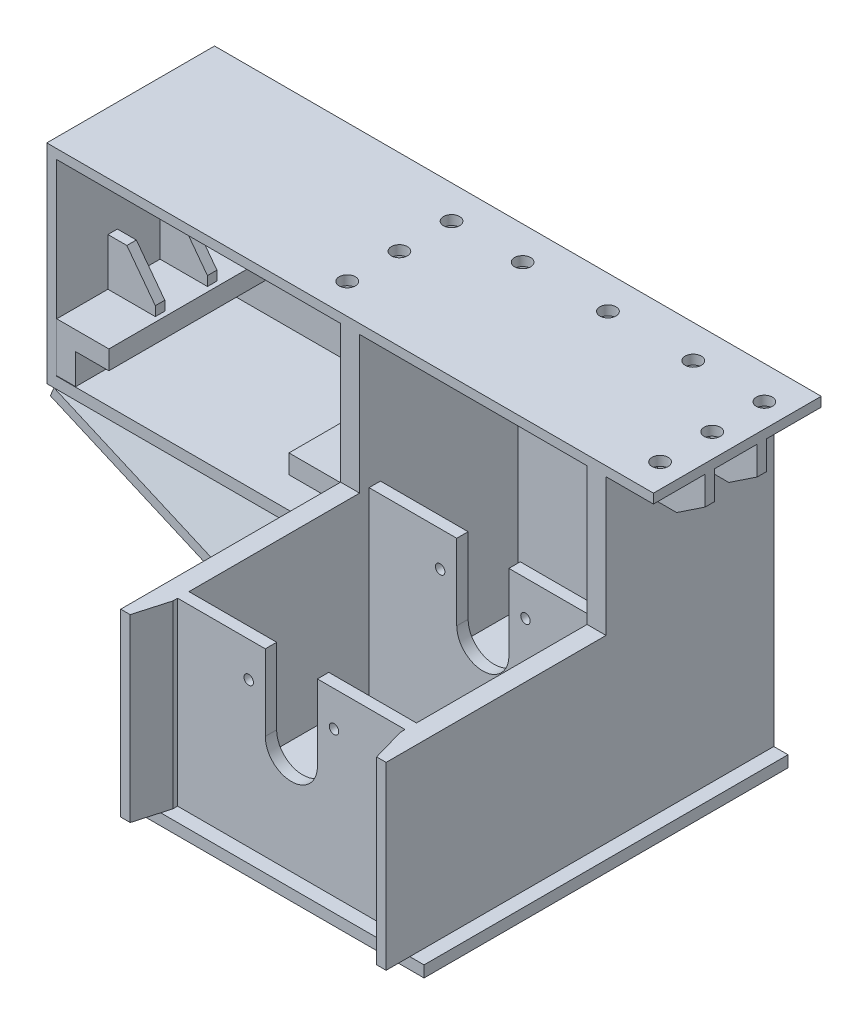
from build123d import *

# Parameters (mm, degrees)
SKETCH_1_W             = 640
SKETCH_1_H             = 177
SKETCH_1_R             = 8.5
EXTRUDE_1_DEPTH        = 10
SKETCH_2_W             = 20
SKETCH_2_H             = 177
EXTRUDE_2_DEPTH        = 335
SKETCH_3_W             = 20
SKETCH_3_H             = 190
EXTRUDE_3_DEPTH        = 232
CUT_EXTRUDE_1_DEPTH    = 764.183464181
SKETCH_5_W             = 240
SKETCH_5_H             = 10
EXTRUDE_4_DEPTH        = 335
SKETCH_6_R             = 35
CUT_EXTRUDE_2_DEPTH    = 10
SKETCH_7_W             = 10
SKETCH_7_H             = 335
EXTRUDE_5_DEPTH        = 300
SKETCH_8_R             = 6
CUT_EXTRUDE_3_DEPTH    = 10
SKETCH_9_W             = 177
SKETCH_9_H             = 210
EXTRUDE_6_DEPTH        = 10
EXTRUDE_7_DEPTH        = 177
SKETCH_12_R            = 5
EXTRUDE_8_DEPTH        = 12
PATTERN_LINEAR_2_COUNT = 2
PATTERN_LINEAR_2_PITCH = 202
SKETCH_14_W            = 300
SKETCH_14_H            = 12
EXTRUDE_9_DEPTH        = 167
SKETCH_15_W            = 166
SKETCH_15_H            = 32
EXTRUDE_10_DEPTH       = 20
SKETCH_16_W            = 55
SKETCH_16_H            = 20
EXTRUDE_11_DEPTH       = 166
EXTRUDE_12_DEPTH       = 166
SKETCH_18_W            = 300
SKETCH_18_H            = 47
SKETCH_18_H_2          = 45
SKETCH_18_H_3          = 54
CUT_EXTRUDE_4_DEPTH    = 50
EXTRUDE_13_DEPTH       = 10
PATTERN_LINEAR_1_COUNT = 2
PATTERN_LINEAR_1_PITCH = 55
SKETCH_21_W            = 313.989613953
SKETCH_21_H            = 384
EXTRUDE_18_DEPTH       = 12


with BuildPart() as part:
    # 草图1 → 凸台-拉伸1 (new body)
    with BuildSketch(Plane(origin=(0, 0, 0), x_dir=(1, 0, 0), z_dir=(0, 1, 0))):
        with Locations((320, 88.5)):
            Rectangle(SKETCH_1_W, SKETCH_1_H)
        with Locations(Location((615, 142, 0), (0, 0, 270))):
            Circle(SKETCH_1_R, mode=Mode.SUBTRACT)
        with Locations(Location((615, 87, 0), (0, 0, 270))):
            Circle(SKETCH_1_R, mode=Mode.SUBTRACT)
        with Locations(Location((615, 32, 0), (0, 0, 270))):
            Circle(SKETCH_1_R, mode=Mode.SUBTRACT)
        with Locations(Location((540, 142, 0), (0, 0, 270))):
            Circle(SKETCH_1_R, mode=Mode.SUBTRACT)
        with Locations(Location((450, 142, 0), (0, 0, 270))):
            Circle(SKETCH_1_R, mode=Mode.SUBTRACT)
        with Locations(Location((360, 142, 0), (0, 0, 270))):
            Circle(SKETCH_1_R, mode=Mode.SUBTRACT)
        with Locations(Location((285, 142, 0), (0, 0, 270))):
            Circle(SKETCH_1_R, mode=Mode.SUBTRACT)
        with Locations(Location((285, 32, 0), (0, 0, 270))):
            Circle(SKETCH_1_R, mode=Mode.SUBTRACT)
        with Locations(Location((285, 87, 0), (0, 0, 270))):
            Circle(SKETCH_1_R, mode=Mode.SUBTRACT)
    extrude(amount=EXTRUDE_1_DEPTH)

    # 草图2 → 凸台-拉伸2 (add)
    with BuildSketch(Plane.XZ):
        with Locations((580, -88.5)):
            Rectangle(SKETCH_2_W, SKETCH_2_H)
        with Locations((320, -88.5)):
            Rectangle(SKETCH_2_W, SKETCH_2_H)
    extrude(amount=EXTRUDE_2_DEPTH)

    # 草图3 → 凸台-拉伸3 (add)
    with BuildSketch(Plane.XY):
        with Locations((580, -240)):
            Rectangle(SKETCH_3_W, SKETCH_3_H)
        with Locations((320, -240)):
            Rectangle(SKETCH_3_W, SKETCH_3_H)
    extrude(amount=EXTRUDE_3_DEPTH)

    # 草图4 → 切除-拉伸1 (cut, through all)
    with BuildSketch(Plane.XZ.offset(335)):
        Polygon((330, 232), (320, 232), (330, 197), align=None)
        Polygon((570, 232), (580, 232), (570, 197), align=None)
    extrude(amount=-CUT_EXTRUDE_1_DEPTH, mode=Mode.SUBTRACT)

    # 草图5 → 凸台-拉伸4 (add)
    with BuildSketch(Plane(origin=(0, 0, 0), x_dir=(-1, 0, 0), z_dir=(0, -1, 0))):
        with Locations((-450, 172)):
            Rectangle(SKETCH_5_W, SKETCH_5_H)
    extrude(amount=EXTRUDE_4_DEPTH)

    # 草图6 → 切除-拉伸2 (cut)
    with BuildSketch(Plane(origin=(0, 0, -177), x_dir=(-1, 0, 0), z_dir=(0, 0, -1))):
        with Locations((-450, -225)):
            Circle(SKETCH_6_R)
    extrude(amount=-CUT_EXTRUDE_2_DEPTH, mode=Mode.SUBTRACT)

    # 草图7 → 凸台-拉伸5 (add)
    with BuildSketch(Plane.ZY.offset(-310)):
        with Locations((-172, -167.5)):
            Rectangle(SKETCH_7_W, SKETCH_7_H)
    extrude(amount=EXTRUDE_5_DEPTH)

    # 草图8 → 切除-拉伸3 (cut)
    with BuildSketch(Plane(origin=(0, 0, -177), x_dir=(-1, 0, 0), z_dir=(0, 0, -1))):
        with Locations((-217, -76)):
            Circle(SKETCH_8_R)
        with Locations((-103, -76)):
            Circle(SKETCH_8_R)
        with Locations((-217, -119)):
            Circle(SKETCH_8_R)
        with Locations((-103, -119)):
            Circle(SKETCH_8_R)
        Polygon((-10, -211), (-295, -335), (-10, -335), align=None)
    extrude(amount=-CUT_EXTRUDE_3_DEPTH, mode=Mode.SUBTRACT)

    # 草图9 → 凸台-拉伸6 (add)
    with BuildSketch(Plane.ZY.offset(-10)):
        with Locations((-88.5, -105)):
            Rectangle(SKETCH_9_W, SKETCH_9_H)
    extrude(amount=EXTRUDE_6_DEPTH)

    # 草图12 → 凸台-拉伸8 (add)
    with BuildSketch(Plane.XY.offset(180)):
        with BuildLine():
            Line((330, -335), (570, -335))
            Line((570, -335), (570, -145))
            Line((570, -145), (477.5, -145))
            Line((477.5, -145), (477.5, -225))
            ThreePointArc((477.5, -225), (450, -252.5), (422.5, -225))
            Line((422.5, -225), (422.5, -145))
            Line((422.5, -145), (330, -145))
            Line((330, -145), (330, -335))
        make_face()
        with Locations((405, -182)):
            Circle(SKETCH_12_R, mode=Mode.SUBTRACT)
        with Locations((495, -182)):
            Circle(SKETCH_12_R, mode=Mode.SUBTRACT)
    extrude_8 = extrude(amount=EXTRUDE_8_DEPTH)

    # 阵列(线性)2: 凸台-拉伸8 ×2
    with Locations(*[(0, 0, -i * PATTERN_LINEAR_2_PITCH) for i in range(1, PATTERN_LINEAR_2_COUNT)]):
        add(extrude_8)

    # 草图14 → 凸台-拉伸9 (add)
    with BuildSketch(Plane.XY.offset(-167)):
        with Locations((160, -204)):
            Rectangle(SKETCH_14_W, SKETCH_14_H)
    extrude(amount=EXTRUDE_9_DEPTH)

    # 草图15 → 凸台-拉伸10 (add)
    with BuildSketch(Plane(origin=(10, 0, 0), x_dir=(0, 0, -1), z_dir=(1, 0, 0))):
        with Locations((83.5, -182)):
            Rectangle(SKETCH_15_W, SKETCH_15_H)
    extrude(amount=EXTRUDE_10_DEPTH)

    # 草图16 → 凸台-拉伸11 (add)
    with BuildSketch(Plane.XY.offset(-0.5)):
        Polygon((310, -146), (310, -198), (290, -198), (290, -166), (255, -166), (255, -146), align=None)
        with Locations((37.5, -156)):
            Rectangle(SKETCH_16_W, SKETCH_16_H)
    extrude(amount=-EXTRUDE_11_DEPTH)

    # 草图17 → 凸台-拉伸12 (add)
    with BuildSketch(Plane.XY.offset(-0.5)):
        Polygon((10, -146), (60, -146), (60, -136), (30, -96), (10, -96), align=None)
        Polygon((310, -146), (260, -146), (260, -136), (290, -96), (310, -96), align=None)
    extrude(amount=-EXTRUDE_12_DEPTH)

    # 草图18 → 切除-拉伸4 (cut)
    with BuildSketch(Plane(origin=(0, -96, 0), x_dir=(1, 0, 0), z_dir=(0, 1, 0))):
        with Locations((160, 143)):
            Rectangle(SKETCH_18_W, SKETCH_18_H)
        with Locations((160, 87)):
            Rectangle(SKETCH_18_W, SKETCH_18_H_2)
        with Locations((160, 27.5)):
            Rectangle(SKETCH_18_W, SKETCH_18_H_3)
    extrude(amount=-CUT_EXTRUDE_4_DEPTH, mode=Mode.SUBTRACT)

    # 草图20 → 凸台-拉伸13 (add)
    with BuildSketch(Plane.XY.offset(-54.5)):
        Polygon((590, 0), (640, 0), (640, -30), (610, -50), (590, -50), align=None)
        Polygon((310, 0), (276.666666667, 0), (276.666666667, -30), (290, -50), (310, -50), align=None)
        Polygon((10, 0), (10, -50), (30, -50), (60, -30), (60, 0), align=None)
    extrude_13 = extrude(amount=-EXTRUDE_13_DEPTH)

    # 阵列(线性)1: 凸台-拉伸13 ×2
    with Locations(*[(0, 0, -i * PATTERN_LINEAR_1_PITCH) for i in range(1, PATTERN_LINEAR_1_COUNT)]):
        add(extrude_13)



with BuildPart() as body_2:
    # 草图11 → 凸台-拉伸7 (new body)
    with BuildSketch(Plane(origin=(0, 0, -177), x_dir=(-1, 0, 0), z_dir=(0, 0, -1))):
        Polygon((-7.71078258, -210.003989614), (-295, -335), (-291.010386047, -344.16967723), (-3.71199895, -219.16967723), (-7.697623289, -210.009169677), align=None)
    extrude(amount=-EXTRUDE_7_DEPTH)


with BuildPart() as part_1:
    add(part.part)

    add(body_2.part)  # 凸台-拉伸18 merges body 2
    # 草图21 → 凸台-拉伸18 (add)
    with BuildSketch(Plane(origin=(0, -335, 0), x_dir=(-1, 0, 0), z_dir=(0, -1, 0))):
        with Locations((-448.005193023, -15)):
            Rectangle(SKETCH_21_W, SKETCH_21_H)
    extrude(amount=EXTRUDE_18_DEPTH)


solid = part_1.part
